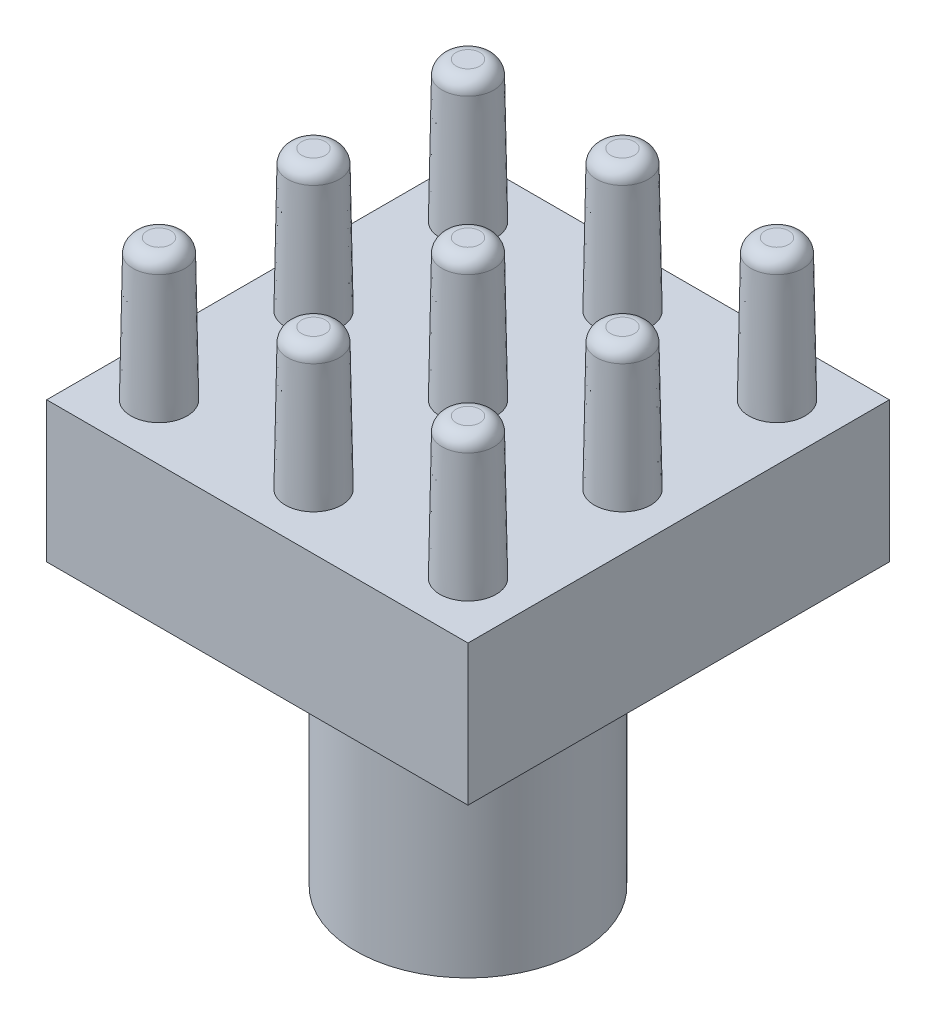
from build123d import *

# Parameters (mm, degrees)
SKETCH1_W                     = 15
SKETCH1_H                     = 15
BOSS_EXTRUDE1_DEPTH           = 5
SKETCH2_R                     = 1
BOSS_EXTRUDE2_DEPTH           = 5
BOSS_EXTRUDE2_DRAFT           = 1
BOSS_EXTRUDE2_PROFILE_2_DEPTH = 5
BOSS_EXTRUDE2_PROFILE_2_DRAFT = 1
BOSS_EXTRUDE2_PROFILE_3_DEPTH = 5
BOSS_EXTRUDE2_PROFILE_3_DRAFT = 1
BOSS_EXTRUDE2_PROFILE_4_DEPTH = 5
BOSS_EXTRUDE2_PROFILE_4_DRAFT = 1
BOSS_EXTRUDE2_PROFILE_5_DEPTH = 5
BOSS_EXTRUDE2_PROFILE_5_DRAFT = 1
BOSS_EXTRUDE2_PROFILE_6_DEPTH = 5
BOSS_EXTRUDE2_PROFILE_6_DRAFT = 1
BOSS_EXTRUDE2_PROFILE_7_DEPTH = 5
BOSS_EXTRUDE2_PROFILE_7_DRAFT = 1
BOSS_EXTRUDE2_PROFILE_8_DEPTH = 5
BOSS_EXTRUDE2_PROFILE_8_DRAFT = 1
BOSS_EXTRUDE2_PROFILE_9_DEPTH = 5
BOSS_EXTRUDE2_PROFILE_9_DRAFT = 1
FILLET4_R                     = 0.5
SKETCH3_R                     = 4
BOSS_EXTRUDE3_DEPTH           = 10


with BuildPart() as part:
    # Sketch1 → Boss-Extrude1 (new body)
    with BuildSketch(Plane(origin=(0, 0, 0), x_dir=(1, 0, 0), z_dir=(0, 1, 0))):
        Rectangle(SKETCH1_W, SKETCH1_H)
    extrude(amount=BOSS_EXTRUDE1_DEPTH)


with BuildPart() as boss_extrude2_tool:
    # Sketch2 → Boss-Extrude2 (with draft: the straight prism first)
    with BuildSketch(Plane(origin=(0, 5, 0), x_dir=(1, 0, 0), z_dir=(0, 1, 0))):
        with Locations((-5.5, 5.5)):
            Circle(SKETCH2_R)
    extrude(amount=BOSS_EXTRUDE2_DEPTH)
    # Boss-Extrude2: the draft: its side faces are tilted about the plane it starts from
    boss_extrude2_sides = [boss_extrude2_tool.faces().sort_by_distance(p)[0] for p in [
        (-6.5, 7.5, -5.5),
    ]]
    draft(boss_extrude2_sides, Plane(origin=(0, 5, 0), x_dir=(1, 0, 0), z_dir=(0, 1, 0)), BOSS_EXTRUDE2_DRAFT)


with BuildPart() as part_1:
    add(part.part)

    # Boss-Extrude2: add boss_extrude2_tool
    add(boss_extrude2_tool.part)


with BuildPart() as boss_extrude2_profile_2_tool:
    # Sketch2 → Boss-Extrude2 profile 2 (with draft: the straight prism first)
    with BuildSketch(Plane(origin=(0, 5, 0), x_dir=(1, 0, 0), z_dir=(0, 1, 0))):
        with Locations((0, 5.5)):
            Circle(SKETCH2_R)
    extrude(amount=BOSS_EXTRUDE2_PROFILE_2_DEPTH)
    # Boss-Extrude2 profile 2: the draft: its side faces are tilted about the plane it starts from
    boss_extrude2_profile_2_sides = [boss_extrude2_profile_2_tool.faces().sort_by_distance(p)[0] for p in [
        (-1, 7.5, -5.5),
    ]]
    draft(boss_extrude2_profile_2_sides, Plane(origin=(0, 5, 0), x_dir=(1, 0, 0), z_dir=(0, 1, 0)), BOSS_EXTRUDE2_PROFILE_2_DRAFT)


with BuildPart() as part_2:
    add(part_1.part)

    # Boss-Extrude2 profile 2: add boss_extrude2_profile_2_tool
    add(boss_extrude2_profile_2_tool.part)


with BuildPart() as boss_extrude2_profile_3_tool:
    # Sketch2 → Boss-Extrude2 profile 3 (with draft: the straight prism first)
    with BuildSketch(Plane(origin=(0, 5, 0), x_dir=(1, 0, 0), z_dir=(0, 1, 0))):
        with Locations((5.5, 5.5)):
            Circle(SKETCH2_R)
    extrude(amount=BOSS_EXTRUDE2_PROFILE_3_DEPTH)
    # Boss-Extrude2 profile 3: the draft: its side faces are tilted about the plane it starts from
    boss_extrude2_profile_3_sides = [boss_extrude2_profile_3_tool.faces().sort_by_distance(p)[0] for p in [
        (4.5, 7.5, -5.5),
    ]]
    draft(boss_extrude2_profile_3_sides, Plane(origin=(0, 5, 0), x_dir=(1, 0, 0), z_dir=(0, 1, 0)), BOSS_EXTRUDE2_PROFILE_3_DRAFT)


with BuildPart() as part_3:
    add(part_2.part)

    # Boss-Extrude2 profile 3: add boss_extrude2_profile_3_tool
    add(boss_extrude2_profile_3_tool.part)


with BuildPart() as boss_extrude2_profile_4_tool:
    # Sketch2 → Boss-Extrude2 profile 4 (with draft: the straight prism first)
    with BuildSketch(Plane(origin=(0, 5, 0), x_dir=(1, 0, 0), z_dir=(0, 1, 0))):
        Circle(SKETCH2_R)
    extrude(amount=BOSS_EXTRUDE2_PROFILE_4_DEPTH)
    # Boss-Extrude2 profile 4: the draft: its side faces are tilted about the plane it starts from
    boss_extrude2_profile_4_sides = [boss_extrude2_profile_4_tool.faces().sort_by_distance(p)[0] for p in [
        (-1, 7.5, 0),
    ]]
    draft(boss_extrude2_profile_4_sides, Plane(origin=(0, 5, 0), x_dir=(1, 0, 0), z_dir=(0, 1, 0)), BOSS_EXTRUDE2_PROFILE_4_DRAFT)


with BuildPart() as part_4:
    add(part_3.part)

    # Boss-Extrude2 profile 4: add boss_extrude2_profile_4_tool
    add(boss_extrude2_profile_4_tool.part)


with BuildPart() as boss_extrude2_profile_5_tool:
    # Sketch2 → Boss-Extrude2 profile 5 (with draft: the straight prism first)
    with BuildSketch(Plane(origin=(0, 5, 0), x_dir=(1, 0, 0), z_dir=(0, 1, 0))):
        with Locations((-5.5, -5.5)):
            Circle(SKETCH2_R)
    extrude(amount=BOSS_EXTRUDE2_PROFILE_5_DEPTH)
    # Boss-Extrude2 profile 5: the draft: its side faces are tilted about the plane it starts from
    boss_extrude2_profile_5_sides = [boss_extrude2_profile_5_tool.faces().sort_by_distance(p)[0] for p in [
        (-6.5, 7.5, 5.5),
    ]]
    draft(boss_extrude2_profile_5_sides, Plane(origin=(0, 5, 0), x_dir=(1, 0, 0), z_dir=(0, 1, 0)), BOSS_EXTRUDE2_PROFILE_5_DRAFT)


with BuildPart() as part_5:
    add(part_4.part)

    # Boss-Extrude2 profile 5: add boss_extrude2_profile_5_tool
    add(boss_extrude2_profile_5_tool.part)


with BuildPart() as boss_extrude2_profile_6_tool:
    # Sketch2 → Boss-Extrude2 profile 6 (with draft: the straight prism first)
    with BuildSketch(Plane(origin=(0, 5, 0), x_dir=(1, 0, 0), z_dir=(0, 1, 0))):
        with Locations((0, -5.5)):
            Circle(SKETCH2_R)
    extrude(amount=BOSS_EXTRUDE2_PROFILE_6_DEPTH)
    # Boss-Extrude2 profile 6: the draft: its side faces are tilted about the plane it starts from
    boss_extrude2_profile_6_sides = [boss_extrude2_profile_6_tool.faces().sort_by_distance(p)[0] for p in [
        (-1, 7.5, 5.5),
    ]]
    draft(boss_extrude2_profile_6_sides, Plane(origin=(0, 5, 0), x_dir=(1, 0, 0), z_dir=(0, 1, 0)), BOSS_EXTRUDE2_PROFILE_6_DRAFT)


with BuildPart() as part_6:
    add(part_5.part)

    # Boss-Extrude2 profile 6: add boss_extrude2_profile_6_tool
    add(boss_extrude2_profile_6_tool.part)


with BuildPart() as boss_extrude2_profile_7_tool:
    # Sketch2 → Boss-Extrude2 profile 7 (with draft: the straight prism first)
    with BuildSketch(Plane(origin=(0, 5, 0), x_dir=(1, 0, 0), z_dir=(0, 1, 0))):
        with Locations((5.5, -5.5)):
            Circle(SKETCH2_R)
    extrude(amount=BOSS_EXTRUDE2_PROFILE_7_DEPTH)
    # Boss-Extrude2 profile 7: the draft: its side faces are tilted about the plane it starts from
    boss_extrude2_profile_7_sides = [boss_extrude2_profile_7_tool.faces().sort_by_distance(p)[0] for p in [
        (4.5, 7.5, 5.5),
    ]]
    draft(boss_extrude2_profile_7_sides, Plane(origin=(0, 5, 0), x_dir=(1, 0, 0), z_dir=(0, 1, 0)), BOSS_EXTRUDE2_PROFILE_7_DRAFT)


with BuildPart() as part_7:
    add(part_6.part)

    # Boss-Extrude2 profile 7: add boss_extrude2_profile_7_tool
    add(boss_extrude2_profile_7_tool.part)


with BuildPart() as boss_extrude2_profile_8_tool:
    # Sketch2 → Boss-Extrude2 profile 8 (with draft: the straight prism first)
    with BuildSketch(Plane(origin=(0, 5, 0), x_dir=(1, 0, 0), z_dir=(0, 1, 0))):
        with Locations((-5.5, 0)):
            Circle(SKETCH2_R)
    extrude(amount=BOSS_EXTRUDE2_PROFILE_8_DEPTH)
    # Boss-Extrude2 profile 8: the draft: its side faces are tilted about the plane it starts from
    boss_extrude2_profile_8_sides = [boss_extrude2_profile_8_tool.faces().sort_by_distance(p)[0] for p in [
        (-6.5, 7.5, 0),
    ]]
    draft(boss_extrude2_profile_8_sides, Plane(origin=(0, 5, 0), x_dir=(1, 0, 0), z_dir=(0, 1, 0)), BOSS_EXTRUDE2_PROFILE_8_DRAFT)


with BuildPart() as part_8:
    add(part_7.part)

    # Boss-Extrude2 profile 8: add boss_extrude2_profile_8_tool
    add(boss_extrude2_profile_8_tool.part)


with BuildPart() as boss_extrude2_profile_9_tool:
    # Sketch2 → Boss-Extrude2 profile 9 (with draft: the straight prism first)
    with BuildSketch(Plane(origin=(0, 5, 0), x_dir=(1, 0, 0), z_dir=(0, 1, 0))):
        with Locations((5.5, 0)):
            Circle(SKETCH2_R)
    extrude(amount=BOSS_EXTRUDE2_PROFILE_9_DEPTH)
    # Boss-Extrude2 profile 9: the draft: its side faces are tilted about the plane it starts from
    boss_extrude2_profile_9_sides = [boss_extrude2_profile_9_tool.faces().sort_by_distance(p)[0] for p in [
        (4.5, 7.5, 0),
    ]]
    draft(boss_extrude2_profile_9_sides, Plane(origin=(0, 5, 0), x_dir=(1, 0, 0), z_dir=(0, 1, 0)), BOSS_EXTRUDE2_PROFILE_9_DRAFT)


with BuildPart() as part_9:
    add(part_8.part)

    # Boss-Extrude2 profile 9: add boss_extrude2_profile_9_tool
    add(boss_extrude2_profile_9_tool.part)

    # Fillet4
    fillet4_edges = [part_9.edges().sort_by_distance(p)[0] for p in [
        (-6.412724675, 10, -5.5),
        (-0.912724675, 10, -5.5),
        (4.587275325, 10, -5.5),
        (-0.912724675, 10, 0),
        (-6.412724675, 10, 5.5),
        (-0.912724675, 10, 5.5),
        (4.587275325, 10, 5.5),
        (-6.412724675, 10, 0),
        (4.587275325, 10, 0),
    ]]
    fillet(fillet4_edges, radius=FILLET4_R)

    # Sketch3 → Boss-Extrude3 (add)
    with BuildSketch(Plane.XZ):
        with Locations(Location((0, 0, 0), (0, 0, 270))):
            Circle(SKETCH3_R)
    extrude(amount=BOSS_EXTRUDE3_DEPTH)


solid = part_9.part
